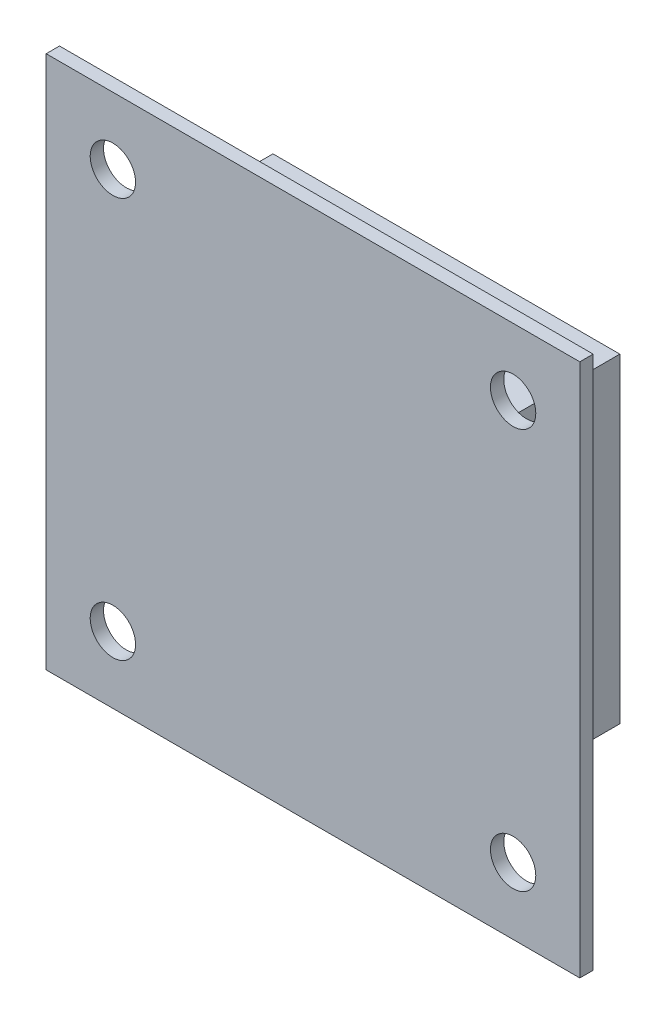
from build123d import *

# Parameters (mm, degrees)
SKETCH1_W                   = 40
SKETCH1_H                   = 40
BOSS_EXTRUDE1_DEPTH         = 1
SKETCH2_W                   = 26
SKETCH2_H                   = 24
BOSS_EXTRUDE2_DEPTH         = 10
LO_M3_BAT_DRIVER_DEPTH      = 31
LO_M3_BAT_DRIVER_DEPTH_BACK = 31
SKETCH3_R                   = 1.7


with BuildPart() as part:
    # Sketch1 → Boss-Extrude1 (new body)
    with BuildSketch(Plane.XY):
        Rectangle(SKETCH1_W, SKETCH1_H)
    extrude(amount=-BOSS_EXTRUDE1_DEPTH)

    # Sketch2 → Boss-Extrude2 (add)
    with BuildSketch(Plane.XY):
        Rectangle(SKETCH2_W, SKETCH2_H)
    extrude(amount=-BOSS_EXTRUDE2_DEPTH)

    # Sketch3 → Lo_M3_bat_driver (cut, two sides: drawn at the far end of the back side and taken through both)
    with BuildSketch(Plane.XY.offset(-LO_M3_BAT_DRIVER_DEPTH_BACK)):
        with Locations(Location((-15, -15, 0), (0, 0, 180))):
            Circle(SKETCH3_R)
        with Locations(Location((-15, 15, 0), (0, 0, 180))):
            Circle(SKETCH3_R)
        with Locations(Location((15, -15, 0), (0, 0, 180))):
            Circle(SKETCH3_R)
        with Locations(Location((15, 15, 0), (0, 0, 180))):
            Circle(SKETCH3_R)
    extrude(amount=LO_M3_BAT_DRIVER_DEPTH + LO_M3_BAT_DRIVER_DEPTH_BACK, mode=Mode.SUBTRACT)


solid = part.part
